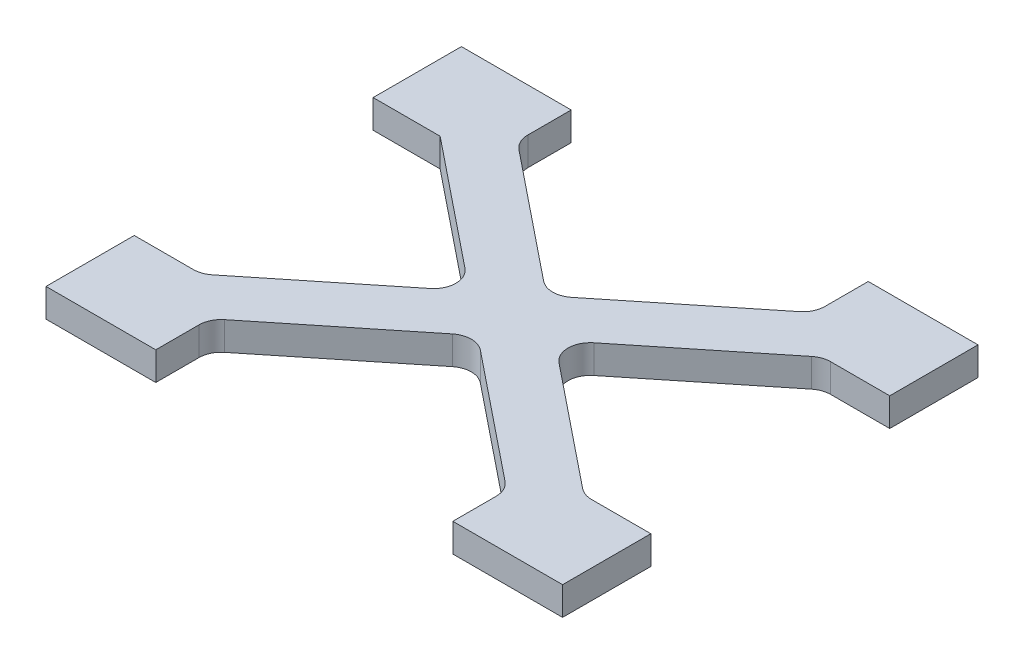
from build123d import *

# Parameters (mm, degrees)
BOSS_EXTRUDE1_DEPTH = 6.35
FILLET1_R           = 5


with BuildPart() as part:
    # Sketch1 → Boss-Extrude1 (new body)
    with BuildSketch(Plane(origin=(0, 0, 0), x_dir=(1, 0, 0), z_dir=(0, 1, 0))):
        Polygon((-57.825, 26.738412941), (-42.825, 26.738412941), (-9.574489714, 0), (-42.825, -26.738412941), (-57.825, -26.738412941), (-57.825, -46.5), (-33.250510286, -46.5), (-33.250510286, -34.437743191), (0, -7.69933025), (33.250510286, -34.437743191), (33.250510286, -46.5), (57.825, -46.5), (57.825, -26.738412941), (42.825, -26.738412941), (9.574489714, 0), (42.825, 26.738412941), (57.825, 26.738412941), (57.825, 46.5), (33.250510286, 46.5), (33.250510286, 34.437743191), (0, 7.69933025), (-33.250510286, 34.437743191), (-33.250510286, 46.5), (-57.825, 46.5), align=None)
    extrude(amount=BOSS_EXTRUDE1_DEPTH)

    # Fillet1
    fillet1_edges = [part.edges().sort_by_distance(p)[0] for p in [
        (-33.250510286, 3.175, -34.437743191),
        (0, 3.175, -7.69933025),
        (33.250510286, 3.175, -34.437743191),
        (42.825, 3.175, -26.738412941),
        (9.574489714, 3.175, 0),
        (42.825, 3.175, 26.738412941),
        (33.250510286, 3.175, 34.437743191),
        (0, 3.175, 7.69933025),
        (-33.250510286, 3.175, 34.437743191),
        (-42.825, 3.175, 26.738412941),
        (-9.574489714, 3.175, 0),
    ]]
    fillet(fillet1_edges, radius=FILLET1_R)


solid = part.part
